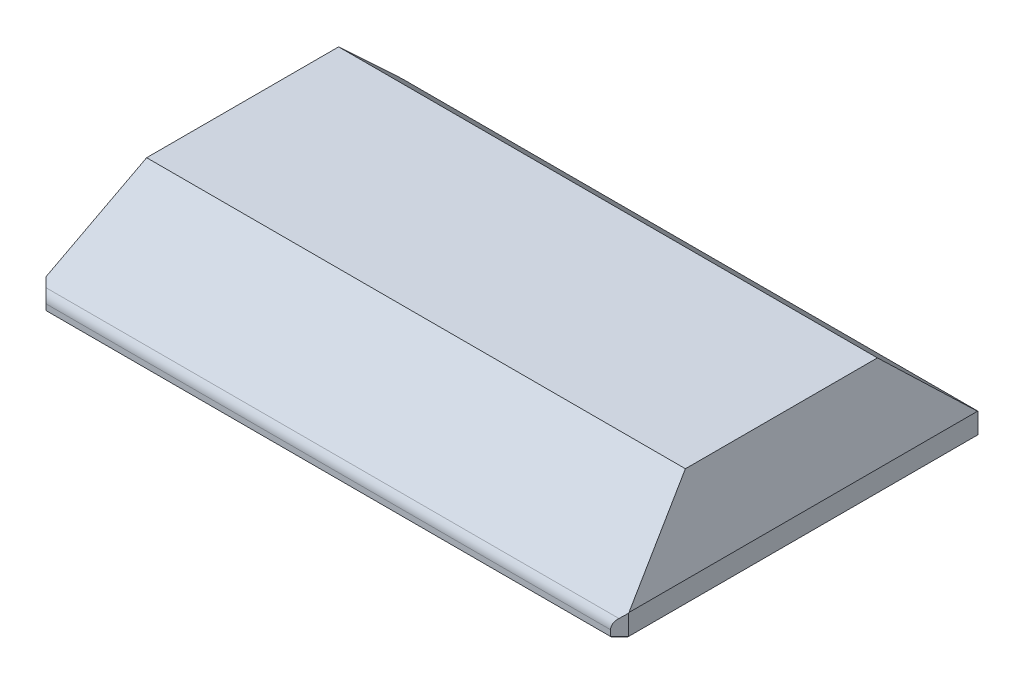
from build123d import *

# Parameters (mm, degrees)
SKETCH1_W               = 130
SKETCH1_H               = 82
BOSS_EXTRUDE1_DEPTH     = 5
CHAMFER1_SIZE           = 2
SKETCH4_R               = 1.2
CUT_EXTRUDE1_DEPTH      = 4
SKETCH5_W               = 114
SKETCH5_H               = 40
CUT_EXTRUDE2_DEPTH      = 21
SKETCH6_W               = 118
SKETCH6_H               = 56
CUT_EXTRUDE3_DEPTH      = 12
SKETCH8_W               = 7
SKETCH8_H               = 7
BOSS_EXTRUDE2_DEPTH     = 8
SKETCH9_R               = 2.1
CUT_EXTRUDE4_DEPTH      = 8
SKETCH10_W              = 2
SKETCH10_H              = 40
CUT_EXTRUDE5_DEPTH      = 9
CUT_EXTRUDE6_DEPTH      = 80.937475727
CUT_EXTRUDE6_DEPTH_BACK = 80.937475727
CUT_EXTRUDE7_DEPTH      = 80.937475727
CUT_EXTRUDE7_DEPTH_BACK = 80.937475727
SKETCH12_W              = 82
SKETCH12_H              = 2
FILLET1_R               = 3
CHAMFER2_SIZE           = 0.4


with BuildPart() as part:
    # Sketch1 → Boss-Extrude1 (new body)
    with BuildSketch(Plane(origin=(0, 0, 0), x_dir=(1, 0, 0), z_dir=(0, 1, 0))):
        Rectangle(SKETCH1_W, SKETCH1_H)
    extrude(amount=BOSS_EXTRUDE1_DEPTH)

    # Sketch3 → Loft2 section 0
    with BuildSketch(Plane(origin=(0, 5, 0), x_dir=(1, 0, 0), z_dir=(0, 1, 0))):
        with BuildLine():
            Line((65, -41), (65, 41))
            Line((65, 41), (-65, 41))
            Line((-65, 41), (-65, -41))
            Line((-65, -41), (65, -41))
        make_face()
    # Sketch2 → Loft2 section 1
    with BuildSketch(Plane(origin=(0, 22, 0), x_dir=(1, 0, 0), z_dir=(0, 1, 0))):
        with BuildLine():
            Line((-60, -23), (60, -23))
            Line((60, -23), (60, 23))
            Line((60, 23), (-60, 23))
            Line((-60, 23), (-60, -23))
        make_face()
    loft()

    # Chamfer1
    chamfer1_edges = [part.edges().sort_by_distance(p)[0] for p in [
        (-65, 2.5, 41),
        (65, 2.5, 41),
        (65, 2.5, -41),
        (-65, 2.5, -41),
    ]]
    chamfer(chamfer1_edges, length=CHAMFER1_SIZE)

    # Sketch4 → Cut-Extrude1 (cut)
    with BuildSketch(Plane.XZ):
        with Locations(Location((40, -37.5, 0), (0, 0, 270))):
            Circle(SKETCH4_R)
        with Locations(Location((-40, -37.5, 0), (0, 0, 270))):
            Circle(SKETCH4_R)
    cut_extrude1 = extrude(amount=-CUT_EXTRUDE1_DEPTH, mode=Mode.SUBTRACT)

    # Sketch5 → Cut-Extrude2 (cut)
    with BuildSketch(Plane.XZ):
        Rectangle(SKETCH5_W, SKETCH5_H)
    extrude(amount=-CUT_EXTRUDE2_DEPTH, mode=Mode.SUBTRACT)

    # Mirror1: Cut-Extrude1 across plane
    add(cut_extrude1.mirror(Plane.XY), mode=Mode.SUBTRACT)

    # Sketch6 → Cut-Extrude3 (cut)
    with BuildSketch(Plane.XZ):
        Rectangle(SKETCH6_W, SKETCH6_H)
    extrude(amount=-CUT_EXTRUDE3_DEPTH, mode=Mode.SUBTRACT)

    # Sketch8 → Boss-Extrude2 (add)
    with BuildSketch(Plane(origin=(0, 4, 0), x_dir=(-1, 0, 0), z_dir=(0, -1, 0))):
        with Locations((-55.5, 24.5)):
            Rectangle(SKETCH8_W, SKETCH8_H)
        with Locations((-55.5, -24.5)):
            Rectangle(SKETCH8_W, SKETCH8_H)
        with Locations((55.5, -24.5)):
            Rectangle(SKETCH8_W, SKETCH8_H)
        with Locations((55.5, 24.5)):
            Rectangle(SKETCH8_W, SKETCH8_H)
    extrude(amount=-BOSS_EXTRUDE2_DEPTH)

    # Sketch9 → Cut-Extrude4 (cut)
    with BuildSketch(Plane.XZ.offset(-4)):
        with Locations(Location((-55.5, 24.5, 0), (0, 0, 270))):
            Circle(SKETCH9_R)
        with Locations(Location((55.5, 24.5, 0), (0, 0, 90))):
            Circle(SKETCH9_R)
        with Locations(Location((55.5, -24.5, 0), (0, 0, 270))):
            Circle(SKETCH9_R)
        with Locations(Location((-55.5, -24.5, 0), (0, 0, 90))):
            Circle(SKETCH9_R)
    extrude(amount=-CUT_EXTRUDE4_DEPTH, mode=Mode.SUBTRACT)

    # Sketch10 → Cut-Extrude5 (cut)
    with BuildSketch(Plane.XZ.offset(-12)):
        with Locations((-58, 0)):
            Rectangle(SKETCH10_W, SKETCH10_H)
        with Locations((58, 0)):
            Rectangle(SKETCH10_W, SKETCH10_H)
    extrude(amount=-CUT_EXTRUDE5_DEPTH, mode=Mode.SUBTRACT)

    # Sketch11 → Cut-Extrude6 (cut, two sides: drawn at the far end of the back side and taken through both)
    with BuildSketch(Plane(origin=(0, 0, 0), x_dir=(0, 0, -1), z_dir=(1, 0, 0)).offset(-CUT_EXTRUDE6_DEPTH_BACK)):
        Polygon((21, 22), (41, 3), (41, 5), (23, 22), align=None)
        Polygon((-23, 22), (-21, 22), (-41, 3), (-41, 5), align=None)
    extrude(amount=CUT_EXTRUDE6_DEPTH + CUT_EXTRUDE6_DEPTH_BACK, mode=Mode.SUBTRACT)

    # Sketch12 → Cut-Extrude7 (cut, two sides: drawn at the far end of the back side and taken through both)
    with BuildSketch(Plane(origin=(0, 0, 0), x_dir=(0, 0, -1), z_dir=(1, 0, 0)).offset(-CUT_EXTRUDE7_DEPTH_BACK)):
        with Locations((0, 22.6)):
            Rectangle(SKETCH12_W, SKETCH12_H)
    extrude(amount=CUT_EXTRUDE7_DEPTH + CUT_EXTRUDE7_DEPTH_BACK, mode=Mode.SUBTRACT)

    # Fillet1
    fillet1_edges = [part.edges().sort_by_distance(p)[0] for p in [
        (0, 3, -41),
        (0, 3, 41),
    ]]
    fillet(fillet1_edges, radius=FILLET1_R)

    # Chamfer2
    chamfer2_edges = [part.edges().sort_by_distance(p)[0] for p in [
        (0, 0, 41),
        (65, 0, 0),
        (-65, 0, 0),
        (0, 0, -41),
        (-64, 0, -40),
        (64, 0, -40),
        (64, 0, 40),
        (-64, 0, 40),
    ]]
    chamfer(chamfer2_edges, length=CHAMFER2_SIZE)


solid = part.part
